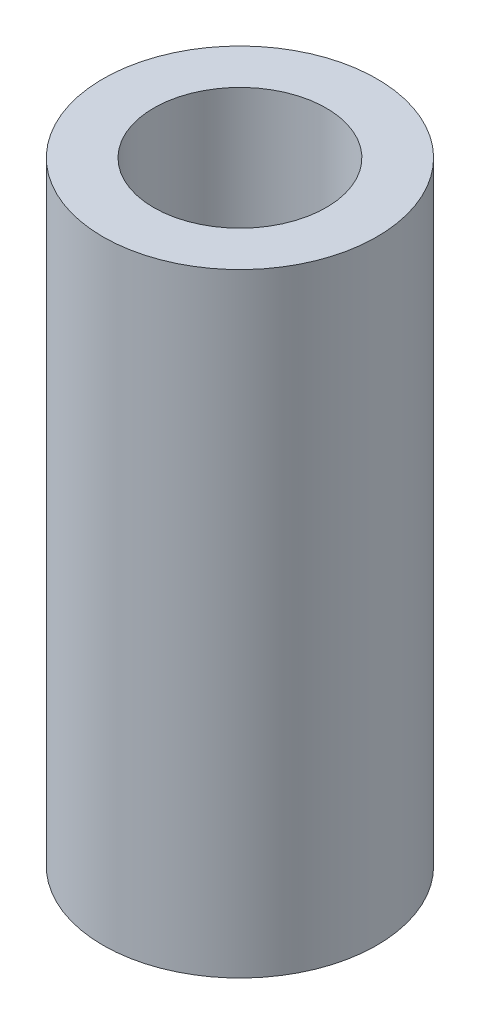
from build123d import *

# Parameters (mm, degrees)
SKETCH1_R           = 6.35
BOSS_EXTRUDE1_DEPTH = 28.449999988
SKETCH3_R           = 4
CUT_EXTRUDE2_DEPTH  = 30.83366386


with BuildPart() as part:
    # Sketch1 → Boss-Extrude1 (new body)
    with BuildSketch(Plane(origin=(0, 0, 0), x_dir=(1, 0, 0), z_dir=(0, 1, 0))):
        with Locations(Location((0, 0, 0), (0, 0, 270))):
            Circle(SKETCH1_R)
    extrude(amount=BOSS_EXTRUDE1_DEPTH)

    # Sketch3 → Cut-Extrude2 (cut, through all)
    with BuildSketch(Plane(origin=(0, 28.449999988, 0), x_dir=(1, 0, 0), z_dir=(0, 1, 0))):
        with Locations(Location((0, 0, 0), (0, 0, 270))):
            Circle(SKETCH3_R)
    extrude(amount=-CUT_EXTRUDE2_DEPTH, mode=Mode.SUBTRACT)


solid = part.part
